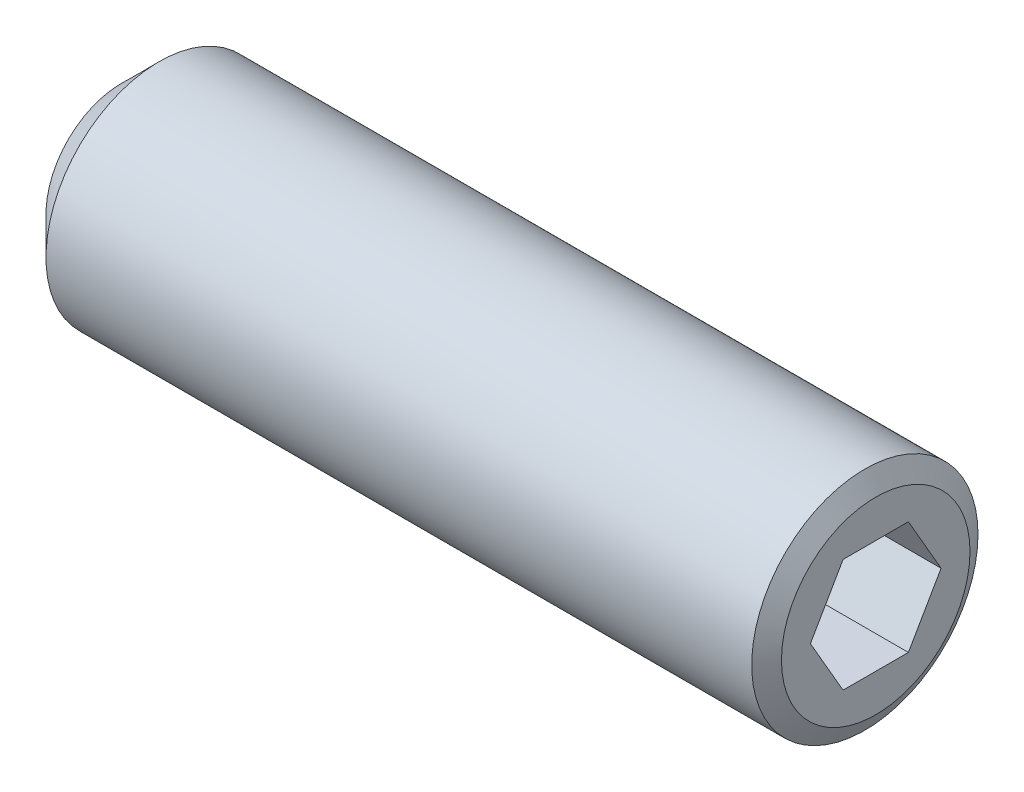
from build123d import *

# Parameters (mm, degrees)
CUT_EXTRUDE1_DEPTH = 3.5
CHAMFER1_SIZE      = 0.288675135
CHAMFER1_SIZE2     = 0.5


with BuildPart() as part:
    # Sketch1 → Revolve1 (revolve)
    with BuildSketch(Plane.XY, mode=Mode.PRIVATE) as revolve1_sk:
        Polygon((-20, 2), (-19, 3), (0, 3), (0, 0), (-20, 0), align=None)
    revolve(revolve1_sk.sketch.rotate(Axis((0, 0, 0), (-1, 0, 0)), 90), axis=Axis((0, 0, 0), (-1, 0, 0)))

    # Sketch2 → Cut-Extrude1 (cut)
    with BuildSketch(Plane(origin=(0, 0, 0), x_dir=(0, 0, -1), z_dir=(1, 0, 0))):
        Polygon((1.732050808, 0), (0.866025404, 1.5), (-0.866025404, 1.5), (-1.732050808, 0), (-0.866025404, -1.5), (0.866025404, -1.5), align=None)
    extrude(amount=-CUT_EXTRUDE1_DEPTH, mode=Mode.SUBTRACT)

    # Chamfer1
    chamfer1_edges = [part.edges().sort_by_distance(p)[0] for p in [
        (0, 0, 3),
    ]]
    chamfer1_side = [part.faces().sort_by_distance(p)[0] for p in [
        (-9.5, 0, 3),
    ]]
    chamfer(chamfer1_edges, length=CHAMFER1_SIZE, length2=CHAMFER1_SIZE2, reference=chamfer1_side[0])


solid = part.part
